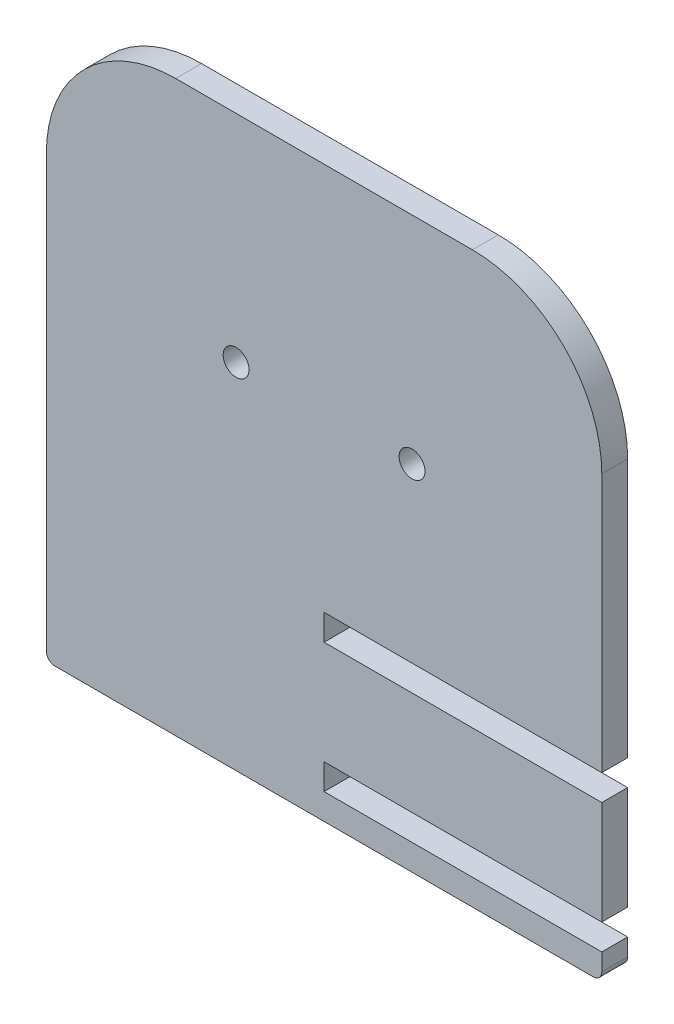
from build123d import *

# Parameters (mm, degrees)
BOSS_EXTRUDE7_DEPTH = 3
SKETCH3_R           = 1.5
CUT_EXTRUDE1_DEPTH  = 3
SKETCH4_W           = 32.2
SKETCH4_H           = 3
CUT_EXTRUDE2_DEPTH  = 3


with BuildPart() as part:
    # Sketch1 → Boss-Extrude7 (new body)
    with BuildSketch(Plane.XY):
        with BuildLine():
            Line((-12.261503554, -6.485084804), (-46.661503554, -6.485084804))
            ThreePointArc((-46.661503554, -6.485084804), (-57.268105272, -10.878483086), (-61.661503554, -21.485084804))
            Line((-61.661503554, -21.485084804), (-61.661503554, -51.485084804))
            Line((-61.661503554, -51.485084804), (-61.661503554, -54.485084804))
            Line((-61.661503554, -54.485084804), (-61.661503554, -71.485084804))
            ThreePointArc((-61.661503554, -71.485084804), (-61.368610335, -72.192191585), (-60.661503554, -72.485084804))
            Line((-60.661503554, -72.485084804), (1.738496446, -72.485084804))
            ThreePointArc((1.738496446, -72.485084804), (2.445603227, -72.192191585), (2.738496446, -71.485084804))
            Line((2.738496446, -71.485084804), (2.738496446, -69.485084804))
            Line((2.738496446, -69.485084804), (-29.461503554, -69.485084804))
            Line((-29.461503554, -69.485084804), (-29.461503554, -66.485084804))
            Line((-29.461503554, -66.485084804), (2.738496446, -66.485084804))
            Line((2.738496446, -66.485084804), (2.738496446, -21.485084804))
            ThreePointArc((2.738496446, -21.485084804), (-1.654901836, -10.878483086), (-12.261503554, -6.485084804))
        make_face()
    extrude(amount=BOSS_EXTRUDE7_DEPTH)

    # Sketch3 → Cut-Extrude1 (cut)
    with BuildSketch(Plane.XY.offset(3)):
        with Locations((-19.261503554, -31.485084804)):
            Circle(SKETCH3_R)
        with Locations((-39.661503554, -31.485084804)):
            Circle(SKETCH3_R)
    extrude(amount=-CUT_EXTRUDE1_DEPTH, mode=Mode.SUBTRACT)

    # Sketch4 → Cut-Extrude2 (cut)
    with BuildSketch(Plane.XY.offset(3)):
        with Locations((-13.361503554, -52.985084804)):
            Rectangle(SKETCH4_W, SKETCH4_H)
    extrude(amount=-CUT_EXTRUDE2_DEPTH, mode=Mode.SUBTRACT)


solid = part.part
